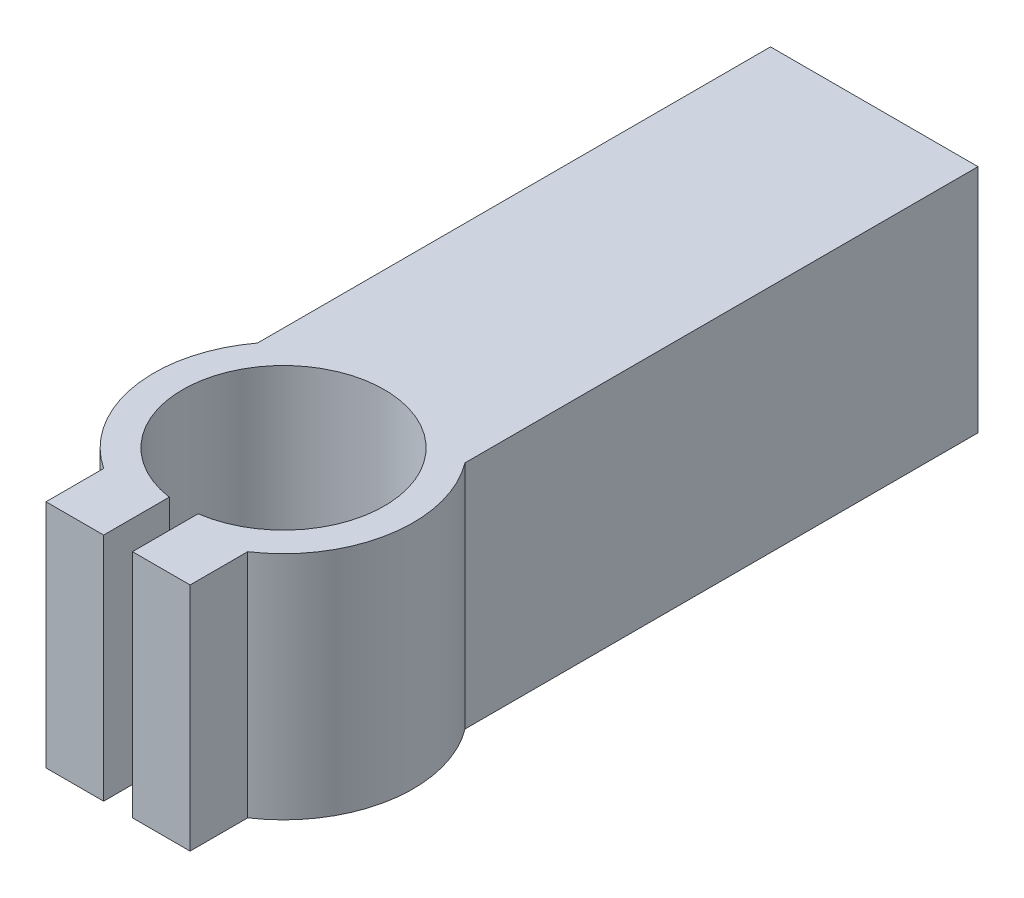
from build123d import *

# Parameters (mm, degrees)
SKETCH1_W           = 45.72
SKETCH1_H           = 101.6
BOSS_EXTRUDE1_DEPTH = 50.8
BOSS_EXTRUDE2_DEPTH = 50.8


with BuildPart() as part:
    # Sketch1 → Boss-Extrude1 (new body)
    with BuildSketch(Plane(origin=(0, 0, 0), x_dir=(1, 0, 0), z_dir=(0, 1, 0))):
        with Locations((22.86, 50.8)):
            Rectangle(SKETCH1_W, SKETCH1_H)
    extrude(amount=BOSS_EXTRUDE1_DEPTH)

    # Sketch4 → Boss-Extrude2 (add)
    with BuildSketch(Plane.XZ):
        with BuildLine():
            Line((0, 0), (0, 11.43))
            ThreePointArc((0, 11.43), (-5.307269755, 33.384941739), (6.985, 52.334524406))
            Line((6.985, 52.334524406), (6.985, 65.034524406))
            Line((6.985, 65.034524406), (19.685, 65.034524406))
            Line((19.685, 65.034524406), (19.685, 50.572045256))
            ThreePointArc((19.685, 50.572045256), (22.86, 6.35), (26.035, 50.572045256))
            Line((26.035, 50.572045256), (26.035, 65.034524406))
            Line((26.035, 65.034524406), (38.735, 65.034524406))
            Line((38.735, 65.034524406), (38.735, 52.334524406))
            ThreePointArc((38.735, 52.334524406), (51.027269755, 33.384941739), (45.72, 11.43))
            Line((45.72, 11.43), (45.72, 0))
            Line((45.72, 0), (0, 0))
        make_face()
    extrude(amount=-BOSS_EXTRUDE2_DEPTH)


solid = part.part
